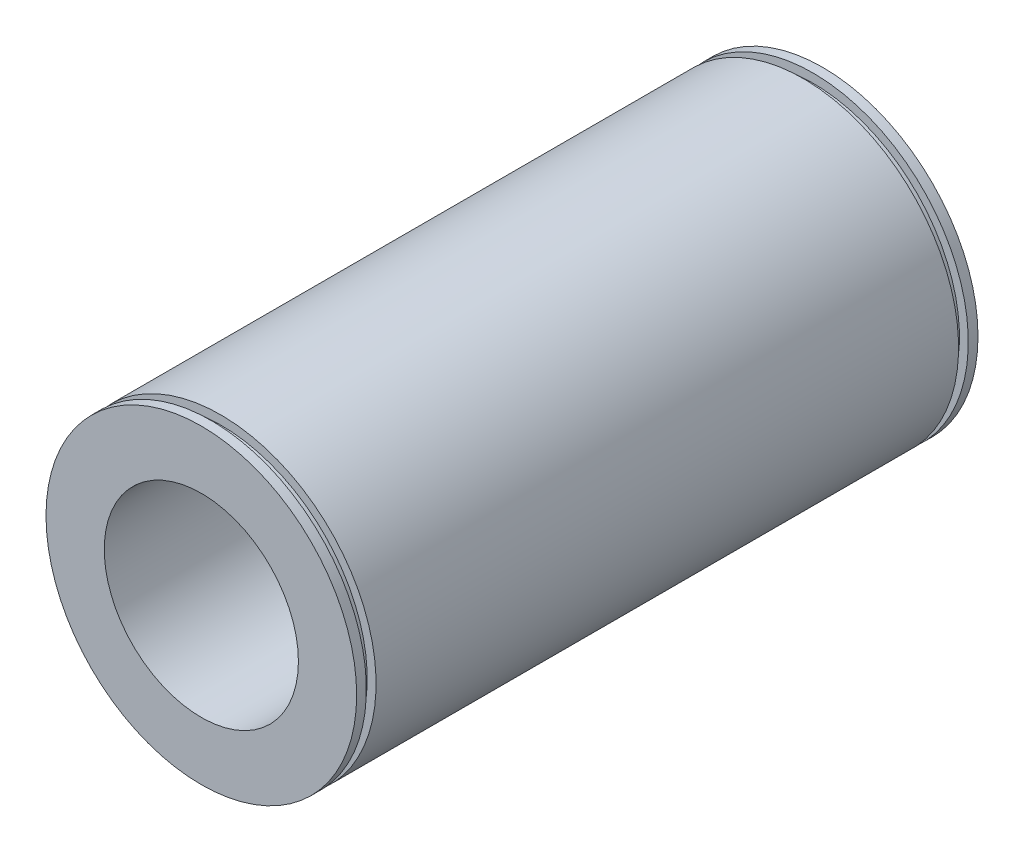
from build123d import *

# Parameters (mm, degrees)
SKETCH1_R           = 25.4
SKETCH1_R_2         = 15.875
BOSS_EXTRUDE1_DEPTH = 50.8
SKETCH2_W           = 1.5875
SKETCH2_H           = 1.4478


with BuildPart() as part:
    # Sketch1 → Boss-Extrude1 (new, symmetric)
    with BuildSketch(Plane.XY):
        Circle(SKETCH1_R)
        Circle(SKETCH1_R_2, mode=Mode.SUBTRACT)
    extrude(amount=BOSS_EXTRUDE1_DEPTH, both=True)

    # Sketch2 → Cut-Revolve1 (revolve, cut)
    with BuildSketch(Plane(origin=(0, 0, 0), x_dir=(0, 0, -1), z_dir=(1, 0, 0)), mode=Mode.PRIVATE) as cut_revolve1_sk:
        with Locations((-48.41875, 24.6761)):
            Rectangle(SKETCH2_W, SKETCH2_H)
    cut_revolve1 = revolve(cut_revolve1_sk.sketch.rotate(Axis((0, 0, 0), (0, 0, 1)), 90), axis=Axis((0, 0, 0), (0, 0, 1)), mode=Mode.SUBTRACT)

    # Mirror1: Cut-Revolve1 across plane
    add(cut_revolve1.mirror(Plane.XY), mode=Mode.SUBTRACT)


solid = part.part
